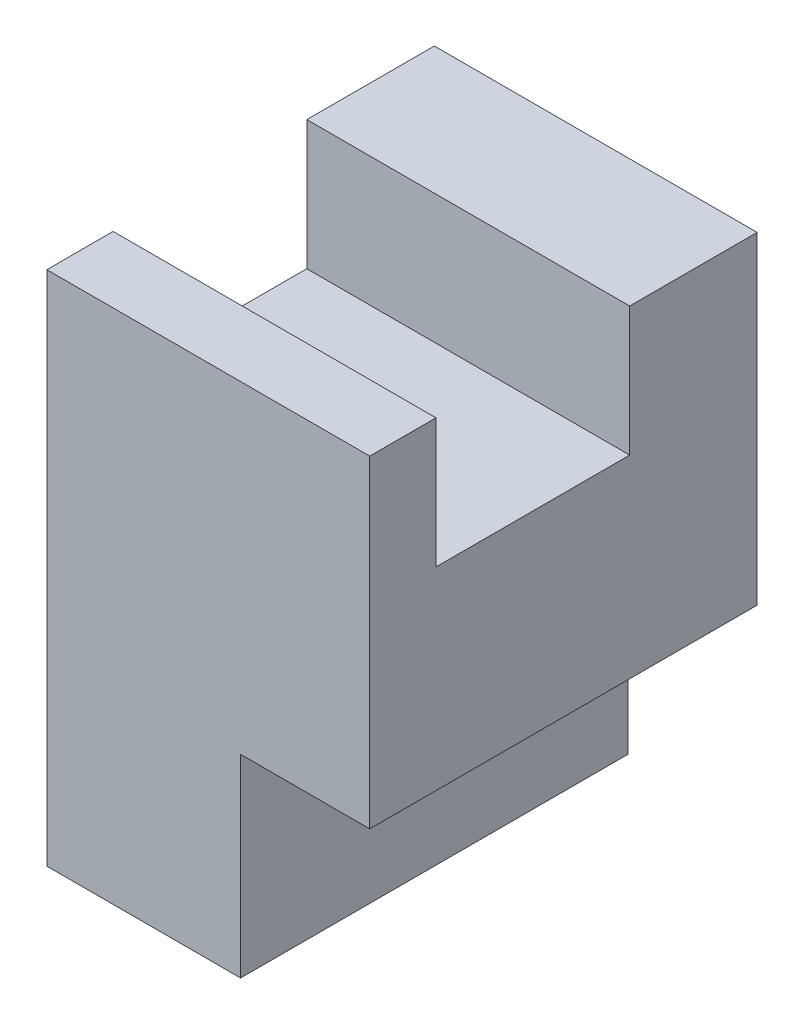
from build123d import *

# Parameters (mm, degrees)
BOSS_EXTRUDE1_DEPTH = 30000
SKETCH2_W           = 25000
SKETCH2_H           = 15000
CUT_EXTRUDE1_DEPTH  = 10000


with BuildPart() as part:
    # Sketch1 → Boss-Extrude1 (new body)
    with BuildSketch(Plane.XY):
        Polygon((0, 0), (15000, 0), (15000, 15000), (25000, 15000), (25000, 40000), (0, 40000), align=None)
    extrude(amount=BOSS_EXTRUDE1_DEPTH)

    # Sketch2 → Cut-Extrude1 (cut)
    with BuildSketch(Plane(origin=(0, 40000, 0), x_dir=(1, 0, 0), z_dir=(0, 1, 0))):
        with Locations((12500, -17369.961500369)):
            Rectangle(SKETCH2_W, SKETCH2_H)
    extrude(amount=-CUT_EXTRUDE1_DEPTH, mode=Mode.SUBTRACT)


solid = part.part
